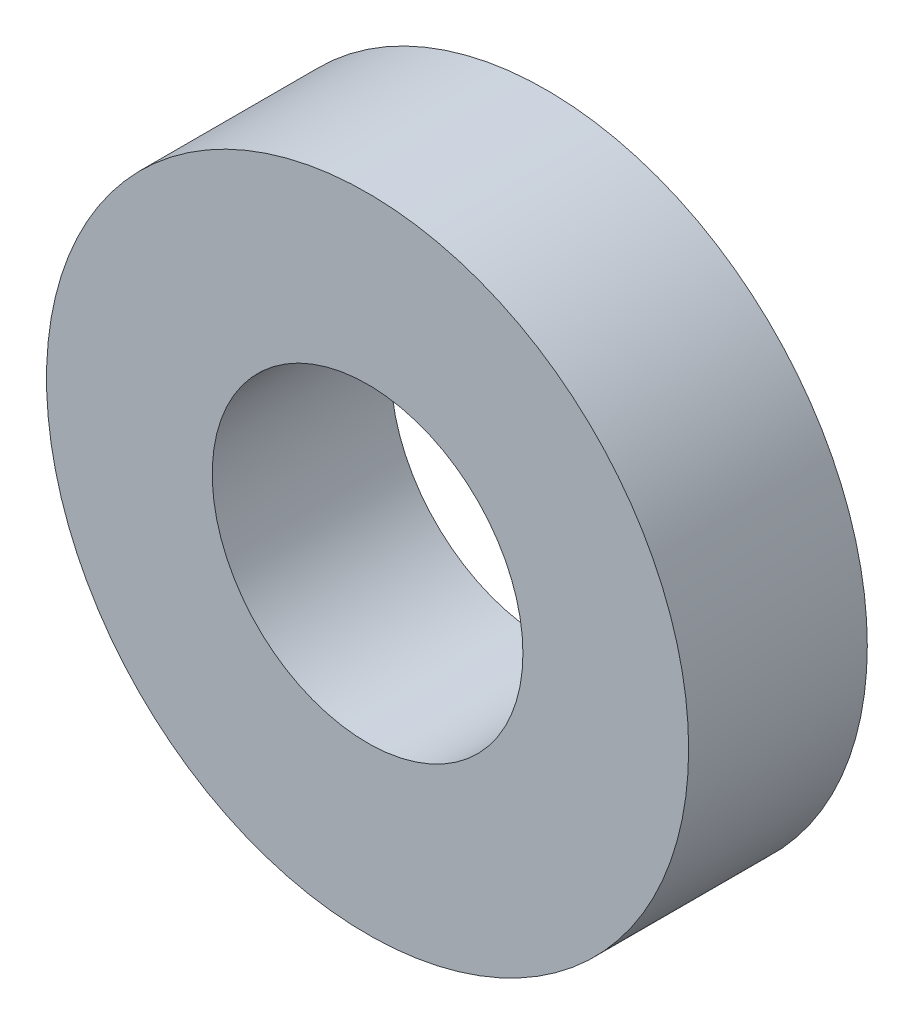
from build123d import *

# Parameters (mm, degrees)
SKETCH1_R           = 31
SKETCH1_R_2         = 15
BOSS_EXTRUDE1_DEPTH = 17.25


with BuildPart() as part:
    # Sketch1 → Boss-Extrude1 (new body)
    with BuildSketch(Plane.XY):
        Circle(SKETCH1_R)
        Circle(SKETCH1_R_2, mode=Mode.SUBTRACT)
    extrude(amount=BOSS_EXTRUDE1_DEPTH)


solid = part.part
